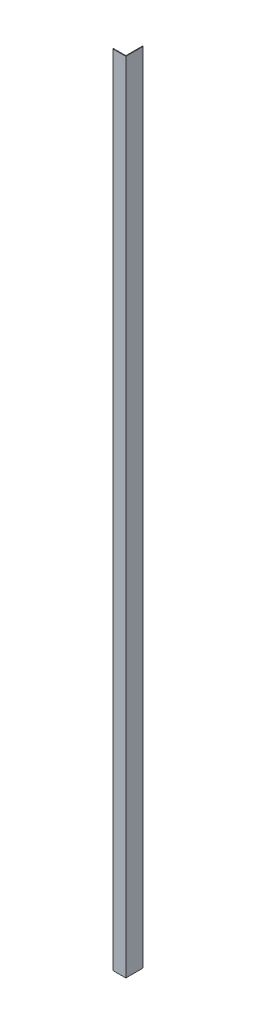
from build123d import *

# Parameters (mm, degrees)
PACK_SOVE_SOL_1_START = 120
PACK_SOVE_SOL_1_DEPTH = 1850


with BuildPart() as part:
    # Sketch1 → PACK_sove_sol_1 (new body)
    with BuildSketch(Plane(origin=(0, 0, 0), x_dir=(1, 0, 0), z_dir=(0, 1, 0)).offset(PACK_SOVE_SOL_1_START)):
        Polygon((0, -40), (0, -38.5), (28.5, -38.5), (28.5, 0), (30, 0), (30, -40), align=None)
    extrude(amount=PACK_SOVE_SOL_1_DEPTH)


solid = part.part
